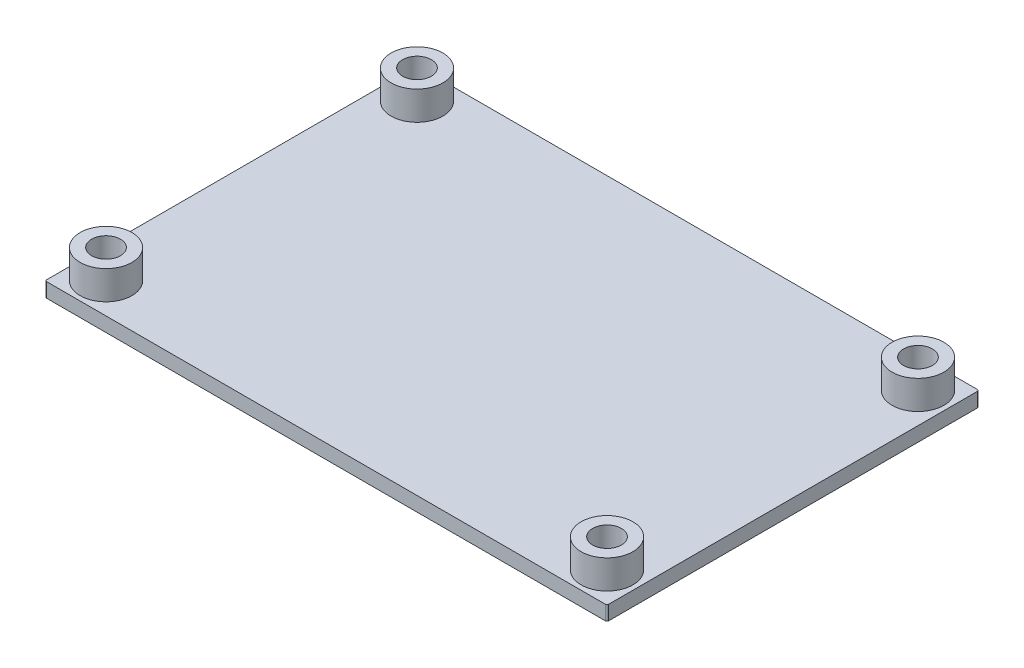
from build123d import *

# Parameters (mm, degrees)
SKETCH2_R             = 4.5
SKETCH2_R_2           = 2.5
BOSS_EXTRUDE2_DEPTH   = 7.5
BOSS_EXTRUDE2_2_DEPTH = 7.5
BOSS_EXTRUDE2_3_DEPTH = 7.5
BOSS_EXTRUDE2_4_DEPTH = 7.5
SKETCH2_10_R          = 4.5
SKETCH2_10_R_2        = 2.5
BOSS_EXTRUDE4_DEPTH   = 2.5


with BuildPart() as part:
    # Sketch2 → Boss-Extrude2 (new body)
    with BuildSketch(Plane(origin=(0, 0, 0), x_dir=(1, 0, 0), z_dir=(0, 1, 0))):
        with Locations((95, 8)):
            Circle(SKETCH2_R)
        with Locations((95, 8)):
            Circle(SKETCH2_R_2, mode=Mode.SUBTRACT)
    extrude(amount=BOSS_EXTRUDE2_DEPTH)



with BuildPart() as body_2:
    # Sketch2 → Boss-Extrude2 2 (new body)
    with BuildSketch(Plane(origin=(0, 0, 0), x_dir=(1, 0, 0), z_dir=(0, 1, 0))):
        with Locations((95, 62)):
            Circle(SKETCH2_R)
        with Locations((95, 62)):
            Circle(SKETCH2_R_2, mode=Mode.SUBTRACT)
    extrude(amount=BOSS_EXTRUDE2_2_DEPTH)


with BuildPart() as body_3:
    # Sketch2 → Boss-Extrude2 3 (new body)
    with BuildSketch(Plane(origin=(0, 0, 0), x_dir=(1, 0, 0), z_dir=(0, 1, 0))):
        with Locations((8, 62)):
            Circle(SKETCH2_R)
        with Locations((8, 62)):
            Circle(SKETCH2_R_2, mode=Mode.SUBTRACT)
    extrude(amount=BOSS_EXTRUDE2_3_DEPTH)


with BuildPart() as body_4:
    # Sketch2 → Boss-Extrude2 4 (new body)
    with BuildSketch(Plane(origin=(0, 0, 0), x_dir=(1, 0, 0), z_dir=(0, 1, 0))):
        with Locations((8, 8)):
            Circle(SKETCH2_R)
        with Locations((8, 8)):
            Circle(SKETCH2_R_2, mode=Mode.SUBTRACT)
    extrude(amount=BOSS_EXTRUDE2_4_DEPTH)


with BuildPart() as part_1:
    add(part.part)

    add(body_2.part)  # Boss-Extrude4 merges body 2

    add(body_3.part)  # Boss-Extrude4 merges body 3

    add(body_4.part)  # Boss-Extrude4 merges body 4
    # Sketch2<10> → Boss-Extrude4 (add)
    # profile 1 of 5: a face of its own
    with BuildSketch(Plane(origin=(0, 0, 0), x_dir=(1, 0, 0), z_dir=(0, 1, 0))):
        with BuildLine():
            ThreePointArc((100, 2.7), (100.212132034, 2.787867966), (100.3, 3))
            Line((100.3, 3), (100.3, 67))
            ThreePointArc((100.3, 67), (100.212132034, 67.212132034), (100, 67.3))
            Line((100, 67.3), (3, 67.3))
            ThreePointArc((3, 67.3), (2.787867966, 67.212132034), (2.7, 67))
            Line((2.7, 67), (2.7, 3))
            ThreePointArc((2.7, 3), (2.787867966, 2.787867966), (3, 2.7))
            Line((3, 2.7), (100, 2.7))
        make_face()
        with Locations((8, 8)):
            Circle(SKETCH2_10_R, mode=Mode.SUBTRACT)
        with Locations((95, 8)):
            Circle(SKETCH2_10_R, mode=Mode.SUBTRACT)
        with Locations((8, 62)):
            Circle(SKETCH2_10_R, mode=Mode.SUBTRACT)
        with Locations((95, 62)):
            Circle(SKETCH2_10_R, mode=Mode.SUBTRACT)
    # profile 2 of 5: a face of its own
    with BuildSketch(Plane(origin=(0, 0, 0), x_dir=(1, 0, 0), z_dir=(0, 1, 0))):
        with Locations((95, 8)):
            Circle(SKETCH2_10_R_2)
    # profile 3 of 5: a face of its own
    with BuildSketch(Plane(origin=(0, 0, 0), x_dir=(1, 0, 0), z_dir=(0, 1, 0))):
        with Locations((95, 62)):
            Circle(SKETCH2_10_R_2)
    # profile 4 of 5: a face of its own
    with BuildSketch(Plane(origin=(0, 0, 0), x_dir=(1, 0, 0), z_dir=(0, 1, 0))):
        with Locations((8, 62)):
            Circle(SKETCH2_10_R_2)
    # profile 5 of 5: a face of its own
    with BuildSketch(Plane(origin=(0, 0, 0), x_dir=(1, 0, 0), z_dir=(0, 1, 0))):
        with Locations((8, 8)):
            Circle(SKETCH2_10_R_2)
    extrude(amount=BOSS_EXTRUDE4_DEPTH)


solid = part_1.part
